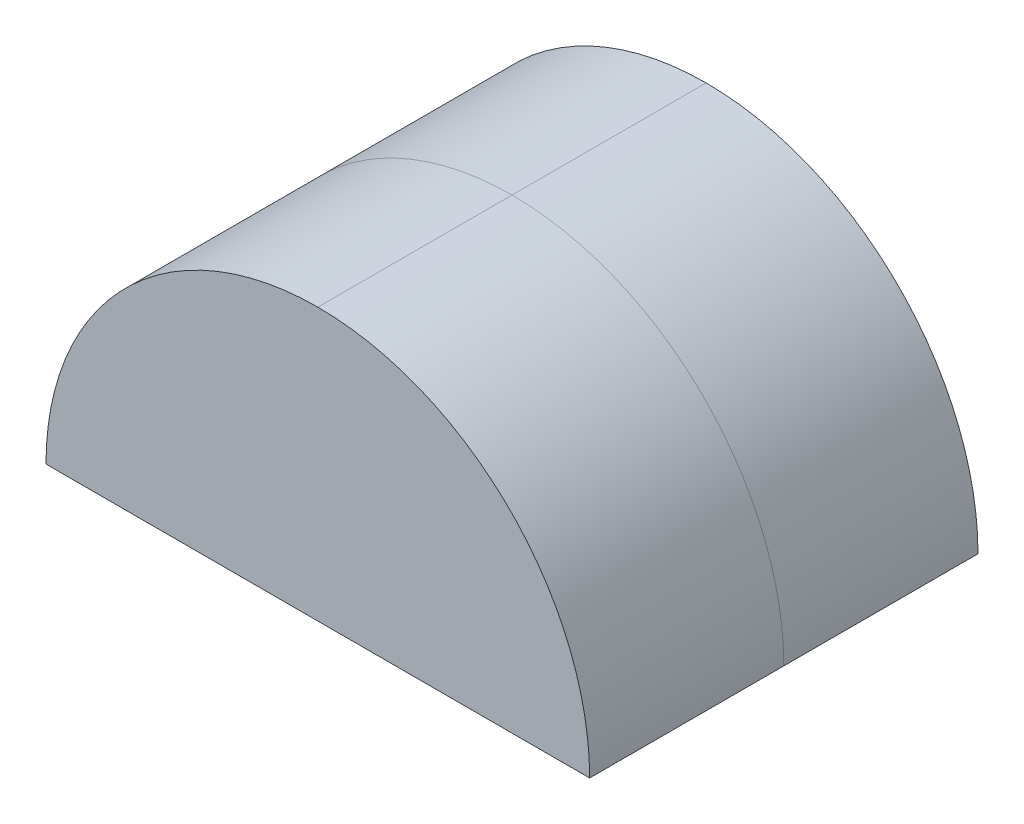
from build123d import *

# Parameters (mm, degrees)
BASE_EXTRUDE_DEPTH = 25.4


with BuildPart() as part:
    # Sketch1 → Base-Extrude (new body)
    with BuildSketch(Plane.XY):
        with BuildLine():
            Line((17.78, 0), (-17.78, 0))
            ThreePointArc((-17.78, 0), (0, 17.78), (17.78, 0))
        make_face()
    extrude(amount=BASE_EXTRUDE_DEPTH)


solid = part.part
